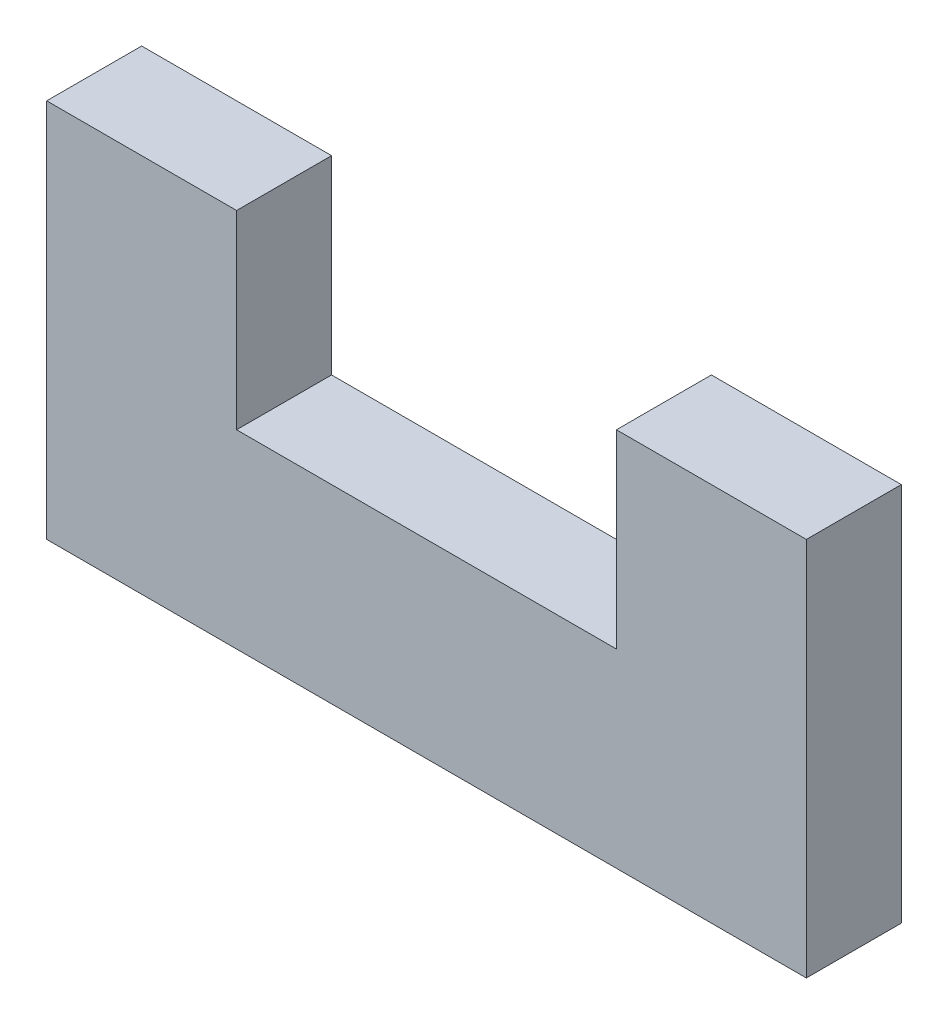
from build123d import *

# Parameters (mm, degrees)
BOSS_EXTRUDE1_DEPTH = 1.5


with BuildPart() as part:
    # Sketch1 → Boss-Extrude1 (new body)
    with BuildSketch(Plane.XY):
        Polygon((-3, 1.5), (-3, -1.5), (3, -1.5), (3, 1.5), (6, 1.5), (6, -4.5), (-6, -4.5), (-6, 1.5), align=None)
    extrude(amount=BOSS_EXTRUDE1_DEPTH)


solid = part.part
